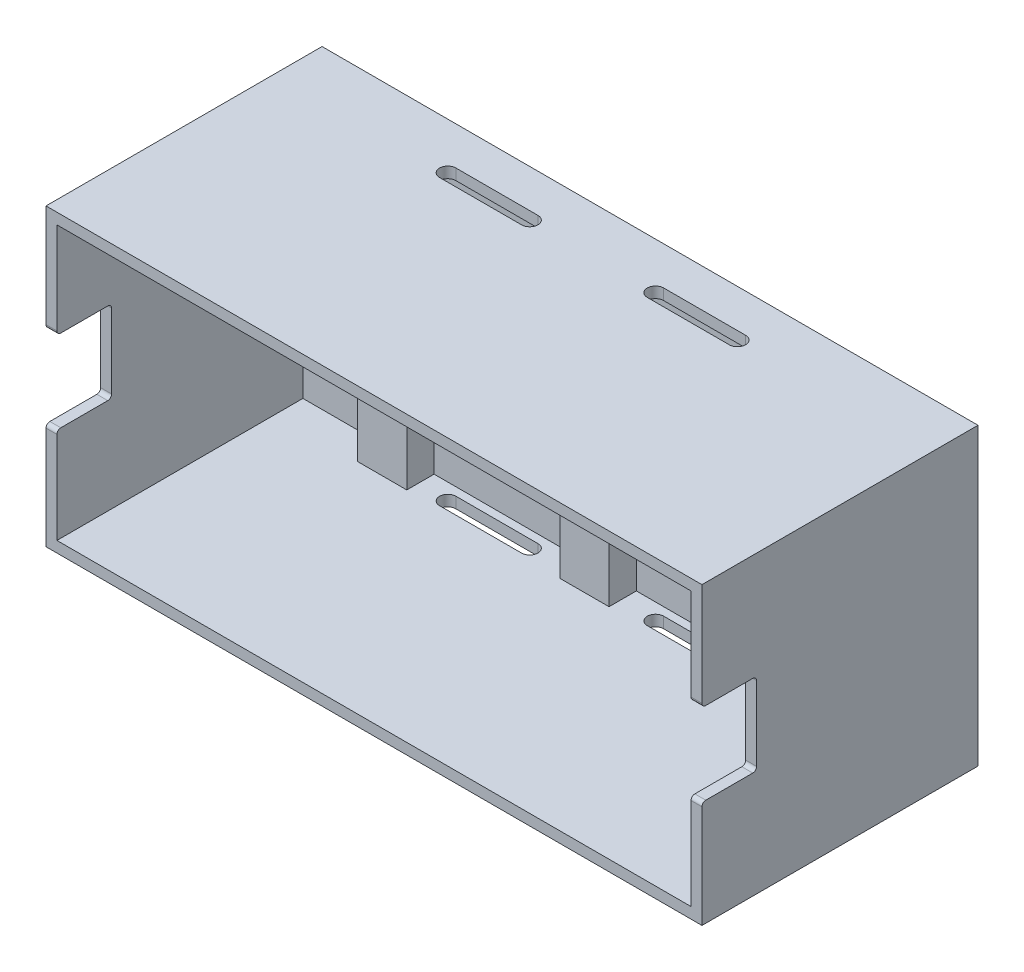
from build123d import *

# Parameters (mm, degrees)
SKETCH1_W               = 120
SKETCH1_H               = 54
BOSS_EXTRUDE1_DEPTH     = 5.5
SKETCH2_W               = 120
SKETCH2_H               = 54
SKETCH2_W_2             = 116
SKETCH2_H_2             = 50
BOSS_EXTRUDE2_DEPTH     = 45
SKETCH3_W               = 9
SKETCH3_H               = 50
BOSS_EXTRUDE3_DEPTH     = 5
SKETCH4_R               = 1.65
CUT_EXTRUDE5_DEPTH      = 14
SKETCH5_W               = 10
SKETCH5_H               = 15
CUT_EXTRUDE7_DEPTH      = 139.416942605
FILLET1_R               = 0.7
FILLET2_R               = 0.7
FILLET3_R               = 0.7
FILLET4_R               = 0.7
FILLET5_R               = 0.7
FILLET6_R               = 0.7
FILLET7_R               = 0.7
FILLET8_R               = 0.7
CUT_EXTRUDE8_DEPTH      = 109.509763737
CUT_EXTRUDE8_DEPTH_BACK = 109.509763737


with BuildPart() as part:
    # Sketch1 → Boss-Extrude1 (new body)
    with BuildSketch(Plane.XY):
        with Locations((-20.747252747, 20)):
            Rectangle(SKETCH1_W, SKETCH1_H)
    extrude(amount=BOSS_EXTRUDE1_DEPTH)

    # Sketch2 → Boss-Extrude2 (add)
    with BuildSketch(Plane.XY.offset(5.5)):
        with Locations((-20.747252747, 20)):
            Rectangle(SKETCH2_W, SKETCH2_H)
        with Locations((-20.747252747, 20)):
            Rectangle(SKETCH2_W_2, SKETCH2_H_2, mode=Mode.SUBTRACT)
    extrude(amount=BOSS_EXTRUDE2_DEPTH)

    # Sketch3 → Boss-Extrude3 (add)
    with BuildSketch(Plane.XY.offset(5.5)):
        with Locations((-59.247252747, 20)):
            Rectangle(SKETCH3_W, SKETCH3_H)
        with Locations((-22.247252747, 20)):
            Rectangle(SKETCH3_W, SKETCH3_H)
        with Locations((14.752747253, 20)):
            Rectangle(SKETCH3_W, SKETCH3_H)
    extrude(amount=BOSS_EXTRUDE3_DEPTH)

    # Sketch4 → Cut-Extrude5 (cut)
    with BuildSketch(Plane.XY.offset(5.5)):
        with Locations((-4.74254548, 39.5)):
            Circle(SKETCH4_R)
        with Locations((-42.205415824, 39.5)):
            Circle(SKETCH4_R)
        with Locations((-72.673636324, 39.5)):
            Circle(SKETCH4_R)
        with Locations((29.282276635, 39.5)):
            Circle(SKETCH4_R)
    extrude(amount=-CUT_EXTRUDE5_DEPTH, mode=Mode.SUBTRACT)

    # Sketch5 → Cut-Extrude7 (cut, through all)
    with BuildSketch(Plane(origin=(39.252747253, 0, 0), x_dir=(0, 0, -1), z_dir=(1, 0, 0))):
        with Locations((-45.5, 20)):
            Rectangle(SKETCH5_W, SKETCH5_H)
    extrude(amount=-CUT_EXTRUDE7_DEPTH, mode=Mode.SUBTRACT)

    # Fillet1
    fillet1_edges = [part.edges().sort_by_distance(p)[0] for p in [
        (38.252747253, 12.5, 40.5),
    ]]
    fillet(fillet1_edges, radius=FILLET1_R)

    # Fillet2
    fillet2_edges = [part.edges().sort_by_distance(p)[0] for p in [
        (38.252747253, 27.5, 40.5),
    ]]
    fillet(fillet2_edges, radius=FILLET2_R)

    # Fillet3
    fillet3_edges = [part.edges().sort_by_distance(p)[0] for p in [
        (-79.747252747, 12.5, 40.5),
    ]]
    fillet(fillet3_edges, radius=FILLET3_R)

    # Fillet4
    fillet4_edges = [part.edges().sort_by_distance(p)[0] for p in [
        (-79.747252747, 27.5, 40.5),
    ]]
    fillet(fillet4_edges, radius=FILLET4_R)

    # Fillet5
    fillet5_edges = [part.edges().sort_by_distance(p)[0] for p in [
        (-79.747252747, 12.5, 50.5),
    ]]
    fillet(fillet5_edges, radius=FILLET5_R)

    # Fillet6
    fillet6_edges = [part.edges().sort_by_distance(p)[0] for p in [
        (-79.747252747, 27.5, 50.5),
    ]]
    fillet(fillet6_edges, radius=FILLET6_R)

    # Fillet7
    fillet7_edges = [part.edges().sort_by_distance(p)[0] for p in [
        (38.252747253, 12.5, 50.5),
    ]]
    fillet(fillet7_edges, radius=FILLET7_R)

    # Fillet8
    fillet8_edges = [part.edges().sort_by_distance(p)[0] for p in [
        (38.252747253, 27.5, 50.5),
    ]]
    fillet(fillet8_edges, radius=FILLET8_R)

    # Sketch6 → Cut-Extrude8 (cut, two sides: drawn at the far end of the back side and taken through both)
    with BuildSketch(Plane(origin=(0, -5, 0), x_dir=(1, 0, 0), z_dir=(0, 1, 0)).offset(-CUT_EXTRUDE8_DEPTH_BACK)):
        with BuildLine():
            Line((-49.247252747, -7), (-34.247252747, -7))
            ThreePointArc((-34.247252747, -7), (-32.747252747, -8.5), (-34.247252747, -10))
            Line((-34.247252747, -10), (-49.247252747, -10))
            ThreePointArc((-49.247252747, -10), (-50.747252747, -8.5), (-49.247252747, -7))
        make_face()
        with BuildLine():
            Line((-11.247252747, -7), (3.752747253, -7))
            ThreePointArc((3.752747253, -7), (5.252747253, -8.5), (3.752747253, -10))
            Line((3.752747253, -10), (-11.247252747, -10))
            ThreePointArc((-11.247252747, -10), (-12.747252747, -8.5), (-11.247252747, -7))
        make_face()
    extrude(amount=CUT_EXTRUDE8_DEPTH + CUT_EXTRUDE8_DEPTH_BACK, mode=Mode.SUBTRACT)


solid = part.part
